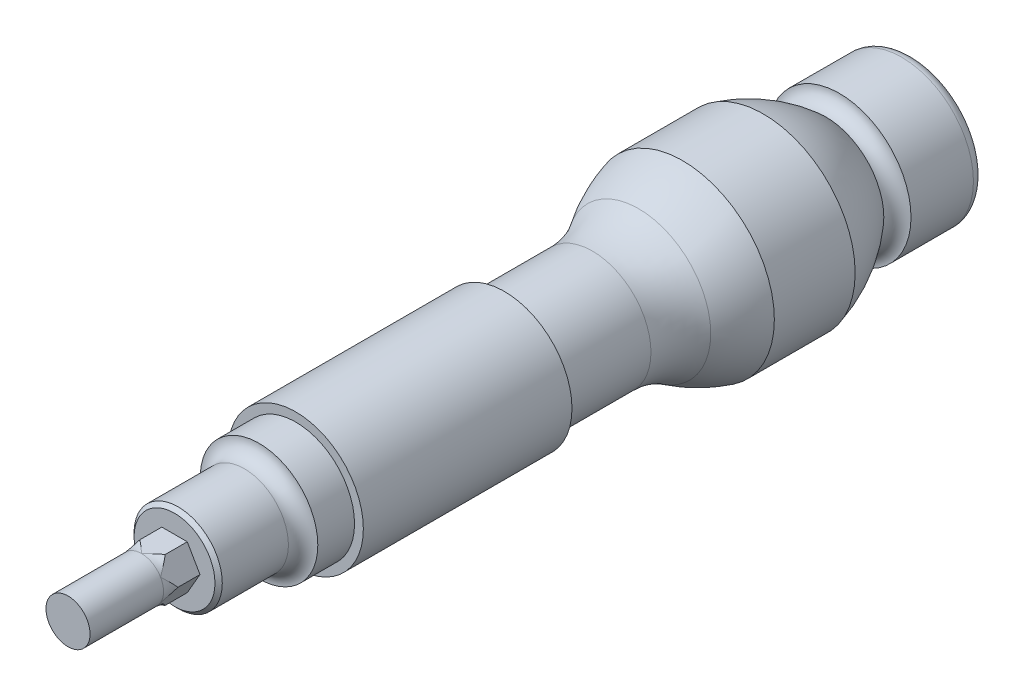
from build123d import *

# Parameters (mm, degrees)
FILLET1_R           = 1.5
CHAMFER1_SIZE       = 0.5
BOSS_EXTRUDE1_DEPTH = 14.5


with BuildPart() as part:
    # Sketch1 → Revolve1 (revolve)
    with BuildSketch(Plane(origin=(0, 0, 0), x_dir=(1, 0, 0), z_dir=(0, 1, 0))):
        with BuildLine():
            Line((0, 0), (0, 100.5))
            Line((0, 100.5), (9.75, 100.5))
            Line((9.75, 100.5), (9.75, 90.5))
            ThreePointArc((9.75, 90.5), (8.441852455, 89.958147545), (7.9, 88.65))
            ThreePointArc((7.9, 88.65), (10.694495807, 84.667609495), (12.5, 80.15))
            Line((12.5, 80.15), (12.5, 69.15))
            ThreePointArc((12.5, 69.15), (11.395638202, 66.053286337), (9.822505168, 63.166332415))
            ThreePointArc((9.822505168, 63.166332415), (8.435454872, 60.164407444), (7.96, 56.89188476))
            Line((7.96, 56.89188476), (7.96, 44.9))
            Line((7.96, 44.9), (9.2, 44.9))
            Line((9.2, 44.9), (9.2, 16.5))
            Line((9.2, 16.5), (8, 16.5))
            Line((8, 16.5), (8, 11.5))
            ThreePointArc((8, 11.5), (6.585786438, 10.914213562), (6, 9.5))
            Line((6, 9.5), (6, 0))
            Line((6, 0), (0, 0))
        make_face()
    revolve(axis=Axis((0, 0, 0), (0, 0, -1)))

    # Fillet1
    fillet1_edges = [part.edges().sort_by_distance(p)[0] for p in [
        (-9.75, 0, -100.5),
    ]]
    fillet(fillet1_edges, radius=FILLET1_R)

    # Chamfer1
    chamfer1_edges = [part.edges().sort_by_distance(p)[0] for p in [
        (-6, 0, 0),
    ]]
    chamfer(chamfer1_edges, length=CHAMFER1_SIZE)

    # Sketch2 → Boss-Extrude1 (add)
    with BuildSketch(Plane.XY):
        Polygon((1.732050808, 3), (-1.732050808, 3), (-3.464101615, 0), (-1.732050808, -3), (1.732050808, -3), (3.464101615, 0), align=None)
    extrude(amount=BOSS_EXTRUDE1_DEPTH)

    # Sketch3 → Cut-Revolve1 (revolve, cut)
    with BuildSketch(Plane(origin=(0, 0, 0), x_dir=(1, 0, 0), z_dir=(0, 1, 0))):
        with BuildLine():
            Line((3, -14.5), (3, -4.5))
            ThreePointArc((3, -4.5), (3.1186767, -3.714921929), (3.464101615, -3))
            Line((3.464101615, -3), (3.464101615, -14.5))
            Line((3.464101615, -14.5), (3, -14.5))
        make_face()
    revolve(axis=Axis((0, 0, 0), (0, 0, 1)), mode=Mode.SUBTRACT)


solid = part.part
